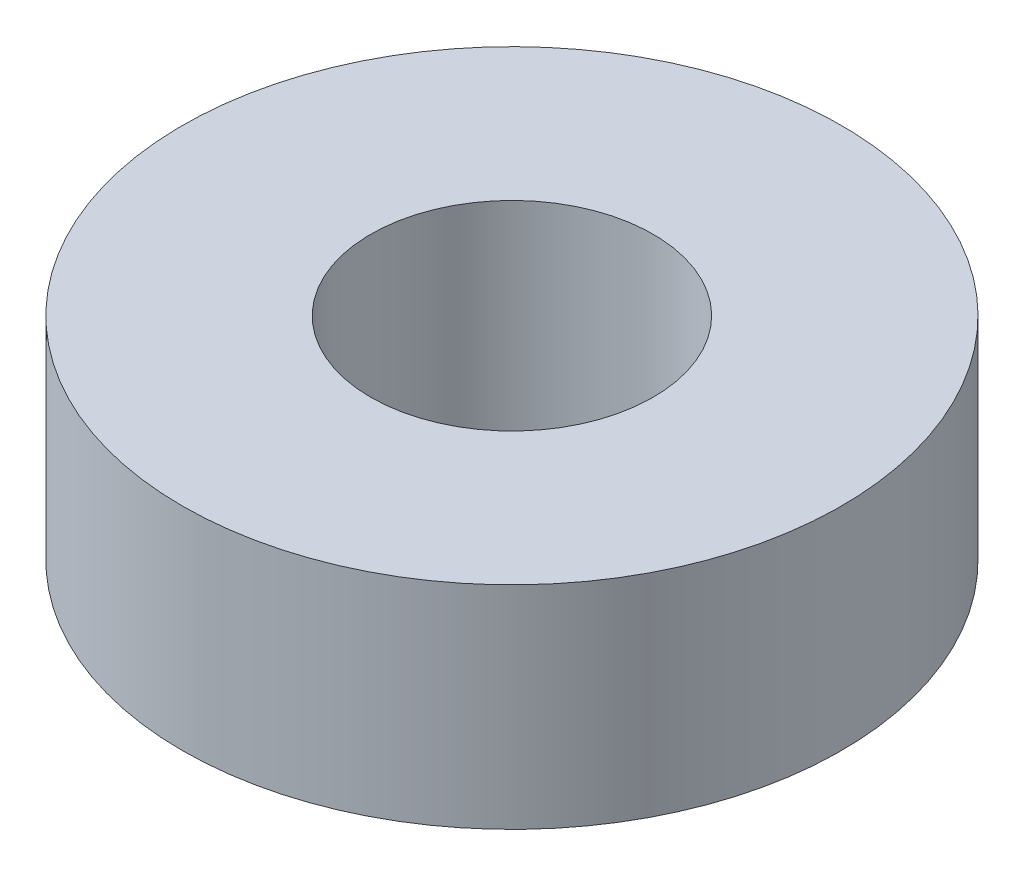
from build123d import *

# Parameters (mm, degrees)
SKETCH1_R           = 11.1125
SKETCH1_R_2         = 4.7625
BOSS_EXTRUDE1_DEPTH = 7.14248


with BuildPart() as part:
    # Sketch1 → Boss-Extrude1 (new body)
    with BuildSketch(Plane(origin=(0, 0, 0), x_dir=(1, 0, 0), z_dir=(0, 1, 0))):
        with Locations(Location((0, 0, 0), (0, 0, 270))):
            Circle(SKETCH1_R)
        with Locations(Location((0, 0, 0), (0, 0, 270))):
            Circle(SKETCH1_R_2, mode=Mode.SUBTRACT)
    extrude(amount=BOSS_EXTRUDE1_DEPTH)


solid = part.part
